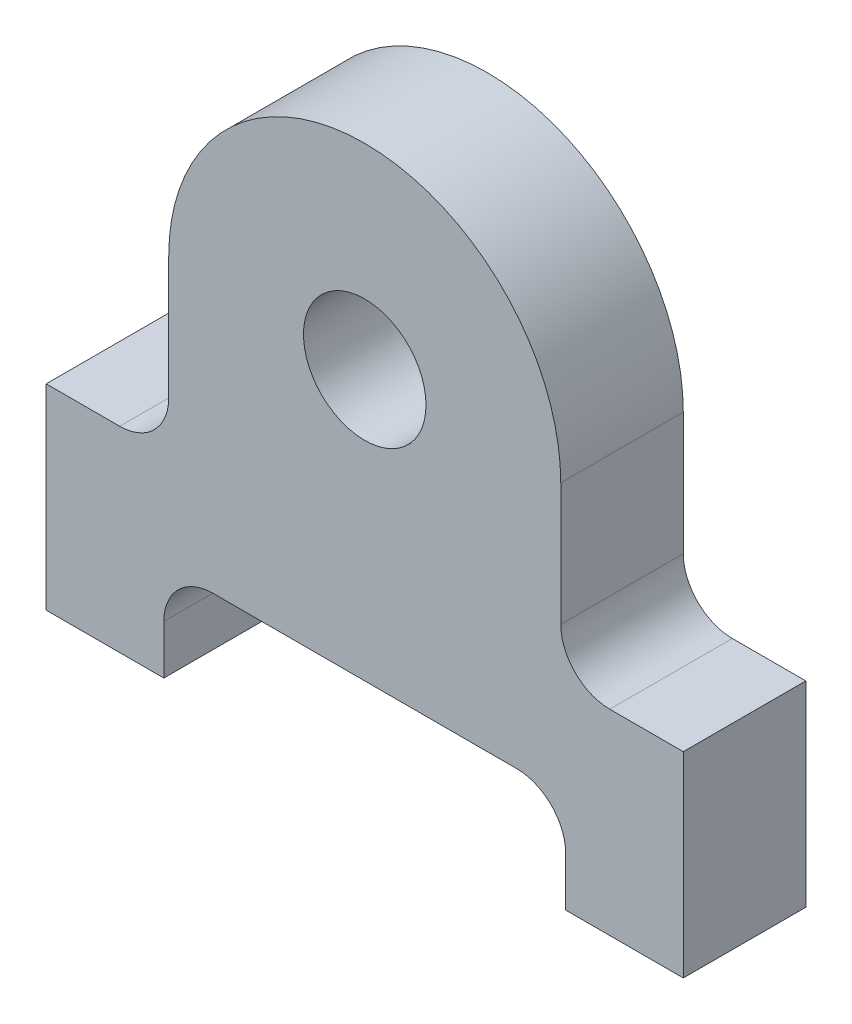
from build123d import *

# Parameters (mm, degrees)
SKETCH1_W                 = 33.02
SKETCH1_H                 = 29.21
BOSS_EXTRUDE1_DEPTH       = 3.175
CUT_EXTRUDE1_REACH        = 24.939
CUT_EXTRUDE2_REACH        = 24.939
SKETCH3_R                 = 3.175
F_6_32_TAPPED_HOLE1_D     = 2.7051
F_6_32_TAPPED_HOLE1_DEPTH = 8.89
F_6_32_TAPPED_HOLE1_TIP   = 0.81269403


with BuildPart() as part:
    # Sketch1 → Boss-Extrude1 (new, symmetric)
    with BuildSketch(Plane.XY):
        Rectangle(SKETCH1_W, SKETCH1_H)
    extrude(amount=BOSS_EXTRUDE1_DEPTH, both=True)

    # Sketch2 → Cut-Extrude1 (cut, up to next)
    with BuildSketch(Plane.XY.offset(3.175), mode=Mode.PRIVATE) as cut_extrude1_sk1:
        with BuildLine():
            Line((-10.16, 4.445), (-10.16, -1.905))
            ThreePointArc((-10.16, -1.905), (-10.903948776, -3.701051224), (-12.7, -4.445))
            Line((-12.7, -4.445), (-16.51, -4.445))
            Line((-16.51, -4.445), (-16.51, 14.605))
            Line((-16.51, 14.605), (0, 14.605))
            ThreePointArc((0, 14.605), (-7.184204897, 11.629204897), (-10.16, 4.445))
        make_face()
    cut_extrude1_tool1 = extrude(cut_extrude1_sk1.sketch, amount=-CUT_EXTRUDE1_REACH, mode=Mode.PRIVATE) & part.part
    # Sketch2 → Cut-Extrude1 (cut, up to next)
    with BuildSketch(Plane.XY.offset(3.175), mode=Mode.PRIVATE) as cut_extrude1_sk2:
        with BuildLine():
            Line((-7.874, -9.525), (0, -9.525))
            Line((0, -9.525), (0, -14.605))
            Line((0, -14.605), (-10.414, -14.605))
            Line((-10.414, -14.605), (-10.414, -12.065))
            ThreePointArc((-10.414, -12.065), (-9.670051224, -10.268948776), (-7.874, -9.525))
        make_face()
    cut_extrude1_tool2 = extrude(cut_extrude1_sk2.sketch, amount=-CUT_EXTRUDE1_REACH, mode=Mode.PRIVATE) & part.part
    cut_extrude1_1 = cut_extrude1_tool1.solids().sort_by_distance((-12.509542, 6.301506, 3.175))[0]
    add(cut_extrude1_1, mode=Mode.SUBTRACT)
    cut_extrude1_2 = cut_extrude1_tool2.solids().sort_by_distance((-5.082313, -12.118013, 3.175))[0]
    add(cut_extrude1_2, mode=Mode.SUBTRACT)
    cut_extrude1 = cut_extrude1_1 + cut_extrude1_2  # Cut-Extrude1 as one shape, for the pattern or mirror that repeats it

    # Mirror1: Cut-Extrude1 across plane
    add(cut_extrude1.mirror(Plane(origin=(0, 0, 0), x_dir=(0, 0, 1), z_dir=(1, 0, 0))), mode=Mode.SUBTRACT)

    # Sketch3 → Cut-Extrude2 (cut, up to next)
    with BuildSketch(Plane.XY.offset(3.175), mode=Mode.PRIVATE) as cut_extrude2_sk1:
        with Locations((0, 4.445)):
            Circle(SKETCH3_R)
    cut_extrude2_tool1 = extrude(cut_extrude2_sk1.sketch, amount=-CUT_EXTRUDE2_REACH, mode=Mode.PRIVATE) & part.part
    add(cut_extrude2_tool1.solids().sort_by_distance((0, 4.445, 3.175))[0], mode=Mode.SUBTRACT)

    # #6-32 Tapped Hole1
    with Locations(Plane(origin=(0, -14.605, 0), x_dir=(-1, 0, 0), z_dir=(0, -1, 0))):
        with Locations((-13.462, 0), (13.462, 0)):
            Hole(F_6_32_TAPPED_HOLE1_D / 2, depth=F_6_32_TAPPED_HOLE1_DEPTH)
            with Locations((0, 0, -(F_6_32_TAPPED_HOLE1_DEPTH + F_6_32_TAPPED_HOLE1_TIP / 2))):  # 118° drill point
                Cone(0, F_6_32_TAPPED_HOLE1_D / 2, F_6_32_TAPPED_HOLE1_TIP, mode=Mode.SUBTRACT)


solid = part.part
